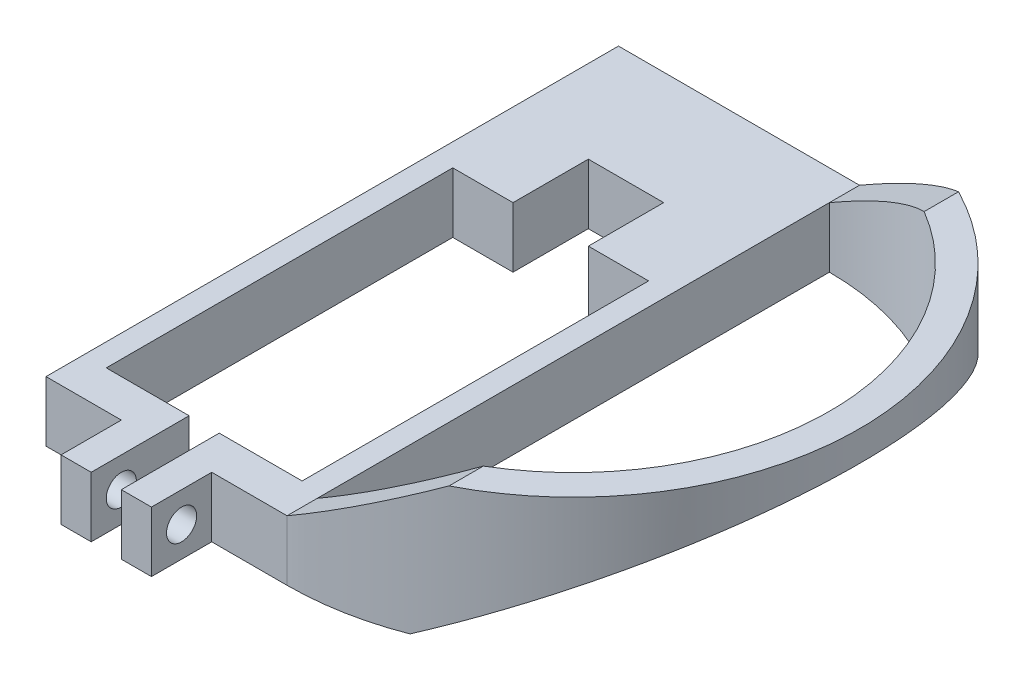
from build123d import *

# Parameters (mm, degrees)
SKETCH1_W           = 13
SKETCH1_H           = 23
BOSS_EXTRUDE1_DEPTH = 4
BOSS_EXTRUDE2_DEPTH = 5
CUT_EXTRUDE1_REACH  = 49.476
CUT_EXTRUDE2_REACH  = 35.392
SKETCH4_W           = 5
SKETCH4_H           = 5
SKETCH4_W_2         = 2
SKETCH4_H_2         = 2.5
SKETCH5_W           = 2
SKETCH5_H           = 4
BOSS_EXTRUDE3_DEPTH = 4
CUT_EXTRUDE3_REACH  = 40.859
SKETCH6_R           = 1


with BuildPart() as part:
    # Sketch1 → Boss-Extrude1 (new body)
    with BuildSketch(Plane(origin=(0, 0, 0), x_dir=(1, 0, 0), z_dir=(0, 1, 0))):
        with BuildLine():
            Line((-8, -19), (8, -19))
            ThreePointArc((8, -19), (27, 0), (8, 19))
            Line((8, 19), (-8, 19))
            Line((-8, 19), (-8, -19))
        make_face()
        with BuildLine():
            Line((8, 17), (8, -17))
            ThreePointArc((8, -17), (25, 0), (8, 17))
        make_face(mode=Mode.SUBTRACT)
        with Locations((0, -5)):
            Rectangle(SKETCH1_W, SKETCH1_H, mode=Mode.SUBTRACT)
    extrude(amount=BOSS_EXTRUDE1_DEPTH)

    # Sketch2 → Boss-Extrude2 (add)
    with BuildSketch(Plane(origin=(0, 4, 0), x_dir=(1, 0, 0), z_dir=(0, 1, 0))):
        with BuildLine():
            Line((8, 19), (8, 17))
            ThreePointArc((8, 17), (25, 0), (8, -17))
            Line((8, -17), (8, -19))
            ThreePointArc((8, -19), (27, 0), (8, 19))
        make_face()
    extrude(amount=BOSS_EXTRUDE2_DEPTH)

    # Cut-Extrude1: up to this face of the body (flat: up to its plane)
    cut_extrude1_end = Plane(part.part.faces().sort_by_distance((0, 2, -19))[0])
    # Sketch3 → Cut-Extrude1 (cut, up to the picked face)
    with BuildSketch(Plane.XY.offset(19), mode=Mode.PRIVATE) as cut_extrude1_sk1:
        Polygon((8, 4), (8, 9), (16.660254038, 9), align=None)
    cut_extrude1_tool1 = split(extrude(cut_extrude1_sk1.sketch, amount=-CUT_EXTRUDE1_REACH, mode=Mode.PRIVATE), bisect_by=cut_extrude1_end, keep=Keep.BOTH, mode=Mode.PRIVATE)
    # Sketch3 → Cut-Extrude1 (cut, up to the picked face)
    with BuildSketch(Plane.XY.offset(19), mode=Mode.PRIVATE) as cut_extrude1_sk2:
        Polygon((27, 7), (14.875644347, 0), (27, 0), align=None)
    cut_extrude1_tool2 = split(extrude(cut_extrude1_sk2.sketch, amount=-CUT_EXTRUDE1_REACH, mode=Mode.PRIVATE), bisect_by=cut_extrude1_end, keep=Keep.BOTH, mode=Mode.PRIVATE)
    add(cut_extrude1_tool1.solids().sort_by(Axis((10.886751, 7.333333, 19), (0, 0, -1)))[0], mode=Mode.SUBTRACT)
    add(cut_extrude1_tool2.solids().sort_by(Axis((22.958548, 2.333333, 19), (0, 0, -1)))[0], mode=Mode.SUBTRACT)

    # Sketch4 → Cut-Extrude2 (cut, up to next)
    with BuildSketch(Plane(origin=(0, 4, 0), x_dir=(1, 0, 0), z_dir=(0, 1, 0)), mode=Mode.PRIVATE) as cut_extrude2_sk1:
        with Locations((0, 9)):
            Rectangle(SKETCH4_W, SKETCH4_H)
    cut_extrude2_tool1 = extrude(cut_extrude2_sk1.sketch, amount=-CUT_EXTRUDE2_REACH, mode=Mode.PRIVATE) & part.part
    # Sketch4 → Cut-Extrude2 (cut, up to next)
    with BuildSketch(Plane(origin=(0, 4, 0), x_dir=(1, 0, 0), z_dir=(0, 1, 0)), mode=Mode.PRIVATE) as cut_extrude2_sk2:
        with Locations((0, -17.75)):
            Rectangle(SKETCH4_W_2, SKETCH4_H_2)
    cut_extrude2_tool2 = extrude(cut_extrude2_sk2.sketch, amount=-CUT_EXTRUDE2_REACH, mode=Mode.PRIVATE) & part.part
    add(cut_extrude2_tool1.solids().sort_by_distance((0, 4, -9))[0], mode=Mode.SUBTRACT)
    add(cut_extrude2_tool2.solids().sort_by_distance((0, 4, 17.75))[0], mode=Mode.SUBTRACT)

    # Sketch5 → Boss-Extrude3 (add)
    with BuildSketch(Plane.XZ):
        with Locations((-2, 21)):
            Rectangle(SKETCH5_W, SKETCH5_H)
    boss_extrude3 = extrude(amount=-BOSS_EXTRUDE3_DEPTH)

    # Sketch6 → Cut-Extrude3 (cut, up to next)
    with BuildSketch(Plane.ZY.offset(3), mode=Mode.PRIVATE) as cut_extrude3_sk1:
        with Locations((21, 2)):
            Circle(SKETCH6_R)
    cut_extrude3_tool1 = extrude(cut_extrude3_sk1.sketch, amount=-CUT_EXTRUDE3_REACH, mode=Mode.PRIVATE) & part.part
    cut_extrude3 = cut_extrude3_tool1.solids().sort_by_distance((-3, 2, 21))[0]
    add(cut_extrude3, mode=Mode.SUBTRACT)

    # Mirror1: Boss-Extrude3, Cut-Extrude3 across plane
    add(boss_extrude3.mirror(Plane(origin=(0, 0, 0), x_dir=(0, 0, 1), z_dir=(1, 0, 0))))
    add(cut_extrude3.mirror(Plane(origin=(0, 0, 0), x_dir=(0, 0, 1), z_dir=(1, 0, 0))), mode=Mode.SUBTRACT)


solid = part.part
